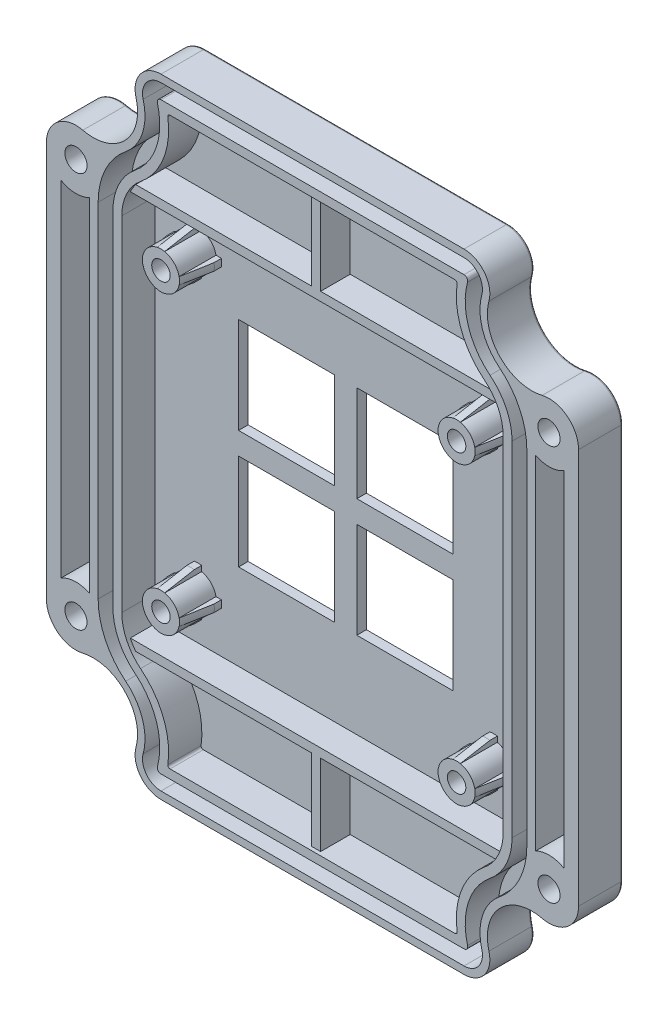
from build123d import *
from OCP.BRepFilletAPI import BRepFilletAPI_MakeChamfer

# Parameters (mm, degrees)
BOSS_EXTRUDE1_DEPTH = 6
SKETCH2_R           = 1.5
CUT_EXTRUDE1_DEPTH  = 6
SKETCH3_R           = 3
CUT_EXTRUDE2_DEPTH  = 3
FILLET1_R           = 0.3
CUT_EXTRUDE3_DEPTH  = 0.2
SKETCH5_W           = 13
SKETCH5_H           = 13
CUT_EXTRUDE4_DEPTH  = 5.8
CUT_EXTRUDE19_START = -4.5
CUT_EXTRUDE19_DEPTH = 4.5
BOSS_EXTRUDE4_DEPTH = 4.5
CUT_EXTRUDE20_DEPTH = 4.5
BOSS_EXTRUDE5_START = 4
BOSS_EXTRUDE5_DEPTH = 4
SKETCH21_R          = 2.5
BOSS_EXTRUDE6_DEPTH = 5
SKETCH22_R          = 1.25
CUT_EXTRUDE21_DEPTH = 5
BOSS_EXTRUDE9_DEPTH = 5
CHAMFER2_SIZE       = 4
CHAMFER2_SIZE2      = 0.705307923
CHAMFER3_SIZE       = 4
CHAMFER3_SIZE2      = 0.705307923
CHAMFER4_SIZE       = 4
CHAMFER4_SIZE2      = 0.705307923


with BuildPart() as part:
    # Sketch1 → Boss-Extrude1 (new body)
    with BuildSketch(Plane.XY):
        with BuildLine():
            Line((0, 69.25), (0, 15.75))
            ThreePointArc((0, 15.75), (1.521768749, 12.610195887), (4.929184933, 11.859419663))
            ThreePointArc((4.929184933, 11.859419663), (10.645991493, 10.192701489), (12.124249822, 4.424289312))
            ThreePointArc((12.124249822, 4.424289312), (12.717464053, 1.376914108), (15.5, 0))
            Line((15.5, 0), (56.5, 0))
            ThreePointArc((56.5, 0), (59.282535947, 1.376914108), (59.875750178, 4.424289312))
            ThreePointArc((59.875750178, 4.424289312), (61.354008507, 10.192701489), (67.070815067, 11.859419663))
            ThreePointArc((67.070815067, 11.859419663), (70.478231251, 12.610195887), (72, 15.75))
            Line((72, 15.75), (72, 69.25))
            ThreePointArc((72, 69.25), (70.478231251, 72.389804113), (67.070815067, 73.140580337))
            ThreePointArc((67.070815067, 73.140580337), (61.354008507, 74.807298511), (59.875750178, 80.575710688))
            ThreePointArc((59.875750178, 80.575710688), (59.282535947, 83.623085892), (56.5, 85))
            Line((56.5, 85), (15.5, 85))
            ThreePointArc((15.5, 85), (12.717464053, 83.623085892), (12.124249822, 80.575710688))
            ThreePointArc((12.124249822, 80.575710688), (10.645991493, 74.807298511), (4.929184933, 73.140580337))
            ThreePointArc((4.929184933, 73.140580337), (1.521768749, 72.389804113), (0, 69.25))
        make_face()
    extrude(amount=BOSS_EXTRUDE1_DEPTH)

    # Sketch2 → Cut-Extrude1 (cut)
    with BuildSketch(Plane.XY.offset(6)):
        with Locations((4, 69.25)):
            Circle(SKETCH2_R)
        with Locations(Location((68, 69.25, 0), (0, 0, 180))):
            Circle(SKETCH2_R)
        with Locations(Location((4, 15.75, 0), (0, 0, 180))):
            Circle(SKETCH2_R)
        with Locations((68, 15.75)):
            Circle(SKETCH2_R)
    extrude(amount=-CUT_EXTRUDE1_DEPTH, mode=Mode.SUBTRACT)

    # Sketch3 → Cut-Extrude2 (cut)
    with BuildSketch(Plane(origin=(0, 0, 0), x_dir=(-1, 0, 0), z_dir=(0, 0, -1))):
        with Locations((-68, 69.25)):
            Circle(SKETCH3_R)
        with Locations((-4, 69.25)):
            Circle(SKETCH3_R)
        with Locations((-68, 15.75)):
            Circle(SKETCH3_R)
        with Locations((-4, 15.75)):
            Circle(SKETCH3_R)
    extrude(amount=-CUT_EXTRUDE2_DEPTH, mode=Mode.SUBTRACT)

    # Fillet1
    fillet1_edges = [part.edges().sort_by_distance(p)[0] for p in [
        (10.645991493, 74.807298511, 0),
        (12.717464053, 83.623085892, 0),
        (36, 85, 0),
        (59.282535947, 83.623085892, 0),
        (61.354008507, 74.807298511, 0),
        (70.478231251, 72.389804113, 0),
        (72, 42.5, 0),
        (70.478231251, 12.610195887, 0),
        (61.354008507, 10.192701489, 0),
        (59.282535947, 1.376914108, 0),
        (36, 0, 0),
        (12.717464053, 1.376914108, 0),
        (10.645991493, 10.192701489, 0),
        (1.521768749, 12.610195887, 0),
        (0, 42.5, 0),
        (1.521768749, 72.389804113, 0),
        (7, 69.25, 0),
        (71, 15.75, 0),
        (7, 15.75, 0),
        (71, 69.25, 0),
    ]]
    fillet(fillet1_edges, radius=FILLET1_R)

    # Sketch4 → Cut-Extrude3 (cut)
    with BuildSketch(Plane(origin=(0, 0, 0), x_dir=(-1, 0, 0), z_dir=(0, 0, -1))):
        with BuildLine():
            Line((-58, 66.5), (-14, 66.5))
            ThreePointArc((-14, 66.5), (-12.585786438, 65.914213562), (-12, 64.5))
            Line((-12, 64.5), (-12, 20.5))
            ThreePointArc((-12, 20.5), (-12.585786438, 19.085786438), (-14, 18.5))
            Line((-14, 18.5), (-58, 18.5))
            ThreePointArc((-58, 18.5), (-59.414213562, 19.085786438), (-60, 20.5))
            Line((-60, 20.5), (-60, 64.5))
            ThreePointArc((-60, 64.5), (-59.414213562, 65.914213562), (-58, 66.5))
        make_face()
    extrude(amount=-CUT_EXTRUDE3_DEPTH, mode=Mode.SUBTRACT)

    # Sketch5 → Cut-Extrude4 (cut)
    with BuildSketch(Plane(origin=(0, 0, 0.2), x_dir=(-1, 0, 0), z_dir=(0, 0, -1))):
        with Locations((-28, 50.5)):
            Rectangle(SKETCH5_W, SKETCH5_H)
        with Locations((-44, 50.5)):
            Rectangle(SKETCH5_W, SKETCH5_H)
        with Locations((-44, 34.5)):
            Rectangle(SKETCH5_W, SKETCH5_H)
        with Locations((-28, 34.5)):
            Rectangle(SKETCH5_W, SKETCH5_H)
    extrude(amount=-CUT_EXTRUDE4_DEPTH, mode=Mode.SUBTRACT)

    # Sketch6 → Cut-Extrude19 (cut)
    with BuildSketch(Plane.XY.offset(6).offset(CUT_EXTRUDE19_START)):
        with BuildLine():
            Line((2, 65.785898385), (2, 19.214101615))
            ThreePointArc((2, 19.214101615), (3.886348424, 19.748385089), (5.8, 19.32211422))
            Line((5.8, 19.32211422), (5.8, 65.67788578))
            ThreePointArc((5.8, 65.67788578), (3.886348424, 65.251614911), (2, 65.785898385))
        make_face()
        with BuildLine():
            Line((66.2, 65.67788578), (66.2, 19.32211422))
            ThreePointArc((66.2, 19.32211422), (68.113651576, 19.748385089), (70, 19.214101615))
            Line((70, 19.214101615), (70, 65.785898385))
            ThreePointArc((70, 65.785898385), (68.113651576, 65.251614911), (66.2, 65.67788578))
        make_face()
        with BuildLine():
            Line((7, 19.25829985), (7, 65.74170015))
            ThreePointArc((7, 65.74170015), (7.97930907, 70.057616639), (10.725427028, 73.528209895))
            ThreePointArc((10.725427028, 73.528209895), (12.997790191, 76.831454139), (13.088749873, 80.839793348))
            ThreePointArc((13.088749873, 80.839793348), (13.512474324, 83.016489923), (15.5, 84))
            Line((15.5, 84), (56.5, 84))
            ThreePointArc((56.5, 84), (58.487525676, 83.016489923), (58.911250127, 80.839793348))
            ThreePointArc((58.911250127, 80.839793348), (59.002209809, 76.831454139), (61.274572972, 73.528209895))
            ThreePointArc((61.274572972, 73.528209895), (64.02069093, 70.057616639), (65, 65.74170015))
            Line((65, 65.74170015), (65, 19.25829985))
            ThreePointArc((65, 19.25829985), (64.02069093, 14.942383361), (61.274572972, 11.471790105))
            ThreePointArc((61.274572972, 11.471790105), (59.002209809, 8.168545861), (58.911250127, 4.160206652))
            ThreePointArc((58.911250127, 4.160206652), (58.487525676, 1.983510077), (56.5, 1))
            Line((56.5, 1), (15.5, 1))
            ThreePointArc((15.5, 1), (13.512474324, 1.983510077), (13.088749873, 4.160206652))
            ThreePointArc((13.088749873, 4.160206652), (12.997790191, 8.168545861), (10.725427028, 11.471790105))
            ThreePointArc((10.725427028, 11.471790105), (7.97930907, 14.942383361), (7, 19.25829985))
        make_face()
    extrude(amount=CUT_EXTRUDE19_DEPTH, mode=Mode.SUBTRACT)

    # Sketch13 → Boss-Extrude4 (add)
    with BuildSketch(Plane.XY.offset(1.5)):
        with BuildLine():
            Line((15.5, 82), (56.5, 82))
            ThreePointArc((56.5, 82), (56.897505135, 81.803297985), (56.982250025, 81.36795867))
            ThreePointArc((56.982250025, 81.36795867), (57.099153942, 76.216329463), (60.019658378, 71.970907946))
            ThreePointArc((60.019658378, 71.970907946), (62.216552744, 69.194433341), (63, 65.74170015))
            Line((63, 65.74170015), (63, 19.25829985))
            ThreePointArc((63, 19.25829985), (62.216552744, 15.805566659), (60.019658378, 13.029092054))
            ThreePointArc((60.019658378, 13.029092054), (57.099153942, 8.783670537), (56.982250025, 3.63204133))
            ThreePointArc((56.982250025, 3.63204133), (56.897505135, 3.196702015), (56.5, 3))
            Line((56.5, 3), (15.5, 3))
            ThreePointArc((15.5, 3), (15.102494865, 3.196702015), (15.017749975, 3.63204133))
            ThreePointArc((15.017749975, 3.63204133), (14.900846058, 8.783670537), (11.980341622, 13.029092054))
            ThreePointArc((11.980341622, 13.029092054), (9.783447256, 15.805566659), (9, 19.25829985))
            Line((9, 19.25829985), (9, 65.74170015))
            ThreePointArc((9, 65.74170015), (9.783447256, 69.194433341), (11.980341622, 71.970907946))
            ThreePointArc((11.980341622, 71.970907946), (14.900846058, 76.216329463), (15.017749975, 81.36795867))
            ThreePointArc((15.017749975, 81.36795867), (15.102494865, 81.803297985), (15.5, 82))
        make_face()
    extrude(amount=BOSS_EXTRUDE4_DEPTH)

    # Sketch14 → Cut-Extrude20 (cut)
    with BuildSketch(Plane.XY.offset(6)):
        with BuildLine():
            Line((55.271626352, 80.8), (16.728373648, 80.8))
            ThreePointArc((16.728373648, 80.8), (16.501498406, 80.696284551), (16.431492949, 80.456850833))
            ThreePointArc((16.431492949, 80.456850833), (15.831417865, 75.256349845), (12.733290379, 71.036526777))
            ThreePointArc((12.733290379, 71.036526777), (10.865930167, 68.676523362), (10.2, 65.74170015))
            Line((10.2, 65.74170015), (10.2, 19.25829985))
            ThreePointArc((10.2, 19.25829985), (10.865930167, 16.323476638), (12.733290379, 13.963473223))
            ThreePointArc((12.733290379, 13.963473223), (15.831417865, 9.743650155), (16.431492949, 4.543149167))
            ThreePointArc((16.431492949, 4.543149167), (16.501498406, 4.303715449), (16.728373648, 4.2))
            Line((16.728373648, 4.2), (55.271626352, 4.2))
            ThreePointArc((55.271626352, 4.2), (55.498501594, 4.303715449), (55.568507051, 4.543149167))
            ThreePointArc((55.568507051, 4.543149167), (56.168582135, 9.743650155), (59.266709621, 13.963473223))
            ThreePointArc((59.266709621, 13.963473223), (61.134069833, 16.323476638), (61.8, 19.25829985))
            Line((61.8, 19.25829985), (61.8, 65.74170015))
            ThreePointArc((61.8, 65.74170015), (61.134069833, 68.676523362), (59.266709621, 71.036526777))
            ThreePointArc((59.266709621, 71.036526777), (56.168582135, 75.256349845), (55.568507051, 80.456850833))
            ThreePointArc((55.568507051, 80.456850833), (55.498501594, 80.696284551), (55.271626352, 80.8))
        make_face()
    extrude(amount=-CUT_EXTRUDE20_DEPTH, mode=Mode.SUBTRACT)

    # Sketch17 → Boss-Extrude5 (add)
    with BuildSketch(Plane.XY.offset(1.5).offset(BOSS_EXTRUDE5_START)):
        with BuildLine():
            Line((10.853310486, 68.65), (61.146689514, 68.65))
            ThreePointArc((61.146689514, 68.65), (60.813718714, 69.268834215), (60.418659644, 69.85))
            Line((60.418659644, 69.85), (36.6, 69.85))
            Line((36.6, 69.85), (36.6, 80.8))
            Line((36.6, 80.8), (35.4, 80.8))
            Line((35.4, 80.8), (35.4, 69.85))
            Line((35.4, 69.85), (11.581340356, 69.85))
            ThreePointArc((11.581340356, 69.85), (11.186281286, 69.268834215), (10.853310486, 68.65))
        make_face()
        with BuildLine():
            Line((60.418659644, 15.15), (36.6, 15.15))
            Line((36.6, 15.15), (36.6, 4.2))
            Line((36.6, 4.2), (35.4, 4.2))
            Line((35.4, 4.2), (35.4, 15.15))
            Line((35.4, 15.15), (11.581340356, 15.15))
            ThreePointArc((11.581340356, 15.15), (11.186281286, 15.731165785), (10.853310486, 16.35))
            Line((10.853310486, 16.35), (61.146689514, 16.35))
            ThreePointArc((61.146689514, 16.35), (60.813718714, 15.731165785), (60.418659644, 15.15))
        make_face()
    extrude(amount=-BOSS_EXTRUDE5_DEPTH)

    # Sketch21 → Boss-Extrude6 (add)
    with BuildSketch(Plane.XY.offset(1.5)):
        with Locations((16, 62.5)):
            Circle(SKETCH21_R)
        with Locations(Location((56, 62.5, 0), (0, 0, 180))):
            Circle(SKETCH21_R)
        with Locations((56, 22.5)):
            Circle(SKETCH21_R)
        with Locations(Location((16, 22.5, 0), (0, 0, 180))):
            Circle(SKETCH21_R)
    extrude(amount=BOSS_EXTRUDE6_DEPTH)

    # Sketch22 → Cut-Extrude21 (cut)
    with BuildSketch(Plane.XY.offset(6.5)):
        with Locations((16, 62.5)):
            Circle(SKETCH22_R)
        with Locations(Location((56, 62.5, 0), (0, 0, 180))):
            Circle(SKETCH22_R)
        with Locations((56, 22.5)):
            Circle(SKETCH22_R)
        with Locations(Location((16, 22.5, 0), (0, 0, 180))):
            Circle(SKETCH22_R)
    extrude(amount=-CUT_EXTRUDE21_DEPTH, mode=Mode.SUBTRACT)

    # Sketch23 → Boss-Extrude9 (add)
    with BuildSketch(Plane.XY.offset(1.5)):
        with BuildLine():
            Line((18.449489743, 63), (19.180167892, 63))
            ThreePointArc((19.180167892, 63), (19.219234043, 62.5), (19.180167892, 62))
            Line((19.180167892, 62), (18.449489743, 62))
            ThreePointArc((18.449489743, 62), (18.5, 62.5), (18.449489743, 63))
        make_face()
        with BuildLine():
            Line((53.550510257, 63), (52.819832108, 63))
            ThreePointArc((52.819832108, 63), (52.780765957, 62.5), (52.819832108, 62))
            Line((52.819832108, 62), (53.550510257, 62))
            ThreePointArc((53.550510257, 62), (53.5, 62.5), (53.550510257, 63))
        make_face()
        with BuildLine():
            Line((53.550510257, 22), (52.819832108, 22))
            ThreePointArc((52.819832108, 22), (52.780765957, 22.5), (52.819832108, 23))
            Line((52.819832108, 23), (53.550510257, 23))
            ThreePointArc((53.550510257, 23), (53.5, 22.5), (53.550510257, 22))
        make_face()
        with BuildLine():
            Line((18.449489743, 22), (19.180167892, 22))
            ThreePointArc((19.180167892, 22), (19.219234043, 22.5), (19.180167892, 23))
            Line((19.180167892, 23), (18.449489743, 23))
            ThreePointArc((18.449489743, 23), (18.5, 22.5), (18.449489743, 22))
        make_face()
        with BuildLine():
            Line((15.5, 60.050510257), (15.5, 59.319832108))
            ThreePointArc((15.5, 59.319832108), (16, 59.280765957), (16.5, 59.319832108))
            Line((16.5, 59.319832108), (16.5, 60.050510257))
            ThreePointArc((16.5, 60.050510257), (16, 60), (15.5, 60.050510257))
        make_face()
        with BuildLine():
            Line((15.5, 24.949489743), (15.5, 25.680167892))
            ThreePointArc((15.5, 25.680167892), (16, 25.719234043), (16.5, 25.680167892))
            Line((16.5, 25.680167892), (16.5, 24.949489743))
            ThreePointArc((16.5, 24.949489743), (16, 25), (15.5, 24.949489743))
        make_face()
        with BuildLine():
            Line((56.5, 60.050510257), (56.5, 59.319832108))
            ThreePointArc((56.5, 59.319832108), (56, 59.280765957), (55.5, 59.319832108))
            Line((55.5, 59.319832108), (55.5, 60.050510257))
            ThreePointArc((55.5, 60.050510257), (56, 60), (56.5, 60.050510257))
        make_face()
        with BuildLine():
            Line((55.5, 24.949489743), (55.5, 25.680167892))
            ThreePointArc((55.5, 25.680167892), (56, 25.719234043), (56.5, 25.680167892))
            Line((56.5, 25.680167892), (56.5, 24.949489743))
            ThreePointArc((56.5, 24.949489743), (56, 25), (55.5, 24.949489743))
        make_face()
        with BuildLine():
            Line((58.449489743, 63), (59.180167892, 63))
            ThreePointArc((59.180167892, 63), (59.219234043, 62.5), (59.180167892, 62))
            Line((59.180167892, 62), (58.449489743, 62))
            ThreePointArc((58.449489743, 62), (58.5, 62.5), (58.449489743, 63))
        make_face()
        with BuildLine():
            Line((55.5, 64.949489743), (55.5, 65.680167892))
            ThreePointArc((55.5, 65.680167892), (56, 65.719234043), (56.5, 65.680167892))
            Line((56.5, 65.680167892), (56.5, 64.949489743))
            ThreePointArc((56.5, 64.949489743), (56, 65), (55.5, 64.949489743))
        make_face()
        with BuildLine():
            Line((15.5, 64.949489743), (15.5, 65.680167892))
            ThreePointArc((15.5, 65.680167892), (16, 65.719234043), (16.5, 65.680167892))
            Line((16.5, 65.680167892), (16.5, 64.949489743))
            ThreePointArc((16.5, 64.949489743), (16, 65), (15.5, 64.949489743))
        make_face()
        with BuildLine():
            Line((13.550510257, 62), (12.819832108, 62))
            ThreePointArc((12.819832108, 62), (12.780765957, 62.5), (12.819832108, 63))
            Line((12.819832108, 63), (13.550510257, 63))
            ThreePointArc((13.550510257, 63), (13.5, 62.5), (13.550510257, 62))
        make_face()
        with BuildLine():
            Line((13.550510257, 22), (12.819832108, 22))
            ThreePointArc((12.819832108, 22), (12.780765957, 22.5), (12.819832108, 23))
            Line((12.819832108, 23), (13.550510257, 23))
            ThreePointArc((13.550510257, 23), (13.5, 22.5), (13.550510257, 22))
        make_face()
        with BuildLine():
            Line((16.5, 20.050510257), (16.5, 19.319832108))
            ThreePointArc((16.5, 19.319832108), (16, 19.280765957), (15.5, 19.319832108))
            Line((15.5, 19.319832108), (15.5, 20.050510257))
            ThreePointArc((15.5, 20.050510257), (16, 20), (16.5, 20.050510257))
        make_face()
        with BuildLine():
            Line((56.5, 20.050510257), (56.5, 19.319832108))
            ThreePointArc((56.5, 19.319832108), (56, 19.280765957), (55.5, 19.319832108))
            Line((55.5, 19.319832108), (55.5, 20.050510257))
            ThreePointArc((55.5, 20.050510257), (56, 20), (56.5, 20.050510257))
        make_face()
        with BuildLine():
            Line((58.449489743, 23), (59.180167892, 23))
            ThreePointArc((59.180167892, 23), (59.219234043, 22.5), (59.180167892, 22))
            Line((59.180167892, 22), (58.449489743, 22))
            ThreePointArc((58.449489743, 22), (58.5, 22.5), (58.449489743, 23))
        make_face()
    extrude(amount=BOSS_EXTRUDE9_DEPTH)

    # Chamfer2
    chamfer2_edges = [part.edges().sort_by_distance(p)[0] for p in [
        (16, 59.280765957, 6.5),
    ]]
    chamfer2_side = [part.faces().sort_by_distance(p)[0] for p in [
        (16, 59.280765957, 4),
    ]]
    chamfer(chamfer2_edges, length=CHAMFER2_SIZE, length2=CHAMFER2_SIZE2, reference=chamfer2_side[0])

    # Chamfer3: one chamfer whose edges measure the first distance from different faces: ONE call of the kernel's chamfer builder (chamfer() names one face for all edges)
    chamfer3_edges_1 = [part.edges().sort_by_distance(p)[0] for p in [
        (19.219234043, 62.5, 6.5),
    ]]
    chamfer3_side_1 = [part.faces().sort_by_distance(p)[0] for p in [
        (19.219234043, 62.5, 4),
    ]]
    chamfer3_edges_2 = [part.edges().sort_by_distance(p)[0] for p in [
        (16, 65.719234043, 6.5),
    ]]
    chamfer3_side_2 = [part.faces().sort_by_distance(p)[0] for p in [
        (16, 65.719234043, 4),
    ]]
    chamfer3_edges_3 = [part.edges().sort_by_distance(p)[0] for p in [
        (12.780765957, 62.5, 6.5),
    ]]
    chamfer3_side_3 = [part.faces().sort_by_distance(p)[0] for p in [
        (12.780765957, 62.5, 4),
    ]]
    chamfer3 = BRepFilletAPI_MakeChamfer(part.part.solid().wrapped)
    for e in chamfer3_edges_1:
        chamfer3.Add(CHAMFER3_SIZE, CHAMFER3_SIZE2, e.wrapped, chamfer3_side_1[0].wrapped)  # the first distance lies on this face
    for e in chamfer3_edges_2:
        chamfer3.Add(CHAMFER3_SIZE, CHAMFER3_SIZE2, e.wrapped, chamfer3_side_2[0].wrapped)  # the first distance lies on this face
    for e in chamfer3_edges_3:
        chamfer3.Add(CHAMFER3_SIZE, CHAMFER3_SIZE2, e.wrapped, chamfer3_side_3[0].wrapped)  # the first distance lies on this face
    add(Compound.cast(chamfer3.Shape()), mode=Mode.REPLACE)

    # Chamfer4: one chamfer whose edges measure the first distance from different faces: ONE call of the kernel's chamfer builder (chamfer() names one face for all edges)
    chamfer4_edges_1 = [part.edges().sort_by_distance(p)[0] for p in [
        (52.780765957, 62.5, 6.5),
    ]]
    chamfer4_side_1 = [part.faces().sort_by_distance(p)[0] for p in [
        (52.780765957, 62.5, 4),
    ]]
    chamfer4_edges_2 = [part.edges().sort_by_distance(p)[0] for p in [
        (52.780765957, 22.5, 6.5),
    ]]
    chamfer4_side_2 = [part.faces().sort_by_distance(p)[0] for p in [
        (52.780765957, 22.5, 4),
    ]]
    chamfer4_edges_3 = [part.edges().sort_by_distance(p)[0] for p in [
        (19.219234043, 22.5, 6.5),
    ]]
    chamfer4_side_3 = [part.faces().sort_by_distance(p)[0] for p in [
        (19.219234043, 22.5, 4),
    ]]
    chamfer4_edges_4 = [part.edges().sort_by_distance(p)[0] for p in [
        (16, 25.719234043, 6.5),
    ]]
    chamfer4_side_4 = [part.faces().sort_by_distance(p)[0] for p in [
        (16, 25.719234043, 4),
    ]]
    chamfer4_edges_5 = [part.edges().sort_by_distance(p)[0] for p in [
        (56, 59.280765957, 6.5),
    ]]
    chamfer4_side_5 = [part.faces().sort_by_distance(p)[0] for p in [
        (56, 59.280765957, 4),
    ]]
    chamfer4_edges_6 = [part.edges().sort_by_distance(p)[0] for p in [
        (56, 25.719234043, 6.5),
    ]]
    chamfer4_side_6 = [part.faces().sort_by_distance(p)[0] for p in [
        (56, 25.719234043, 4),
    ]]
    chamfer4_edges_7 = [part.edges().sort_by_distance(p)[0] for p in [
        (59.219234043, 62.5, 6.5),
    ]]
    chamfer4_side_7 = [part.faces().sort_by_distance(p)[0] for p in [
        (59.219234043, 62.5, 4),
    ]]
    chamfer4_edges_8 = [part.edges().sort_by_distance(p)[0] for p in [
        (56, 65.719234043, 6.5),
    ]]
    chamfer4_side_8 = [part.faces().sort_by_distance(p)[0] for p in [
        (56, 65.719234043, 4),
    ]]
    chamfer4_edges_9 = [part.edges().sort_by_distance(p)[0] for p in [
        (12.780765957, 22.5, 6.5),
    ]]
    chamfer4_side_9 = [part.faces().sort_by_distance(p)[0] for p in [
        (12.780765957, 22.5, 4),
    ]]
    chamfer4_edges_10 = [part.edges().sort_by_distance(p)[0] for p in [
        (16, 19.280765957, 6.5),
    ]]
    chamfer4_side_10 = [part.faces().sort_by_distance(p)[0] for p in [
        (16, 19.280765957, 4),
    ]]
    chamfer4_edges_11 = [part.edges().sort_by_distance(p)[0] for p in [
        (56, 19.280765957, 6.5),
    ]]
    chamfer4_side_11 = [part.faces().sort_by_distance(p)[0] for p in [
        (56, 19.280765957, 4),
    ]]
    chamfer4_edges_12 = [part.edges().sort_by_distance(p)[0] for p in [
        (59.219234043, 22.5, 6.5),
    ]]
    chamfer4_side_12 = [part.faces().sort_by_distance(p)[0] for p in [
        (59.219234043, 22.5, 4),
    ]]
    chamfer4 = BRepFilletAPI_MakeChamfer(part.part.solid().wrapped)
    for e in chamfer4_edges_1:
        chamfer4.Add(CHAMFER4_SIZE, CHAMFER4_SIZE2, e.wrapped, chamfer4_side_1[0].wrapped)  # the first distance lies on this face
    for e in chamfer4_edges_2:
        chamfer4.Add(CHAMFER4_SIZE, CHAMFER4_SIZE2, e.wrapped, chamfer4_side_2[0].wrapped)  # the first distance lies on this face
    for e in chamfer4_edges_3:
        chamfer4.Add(CHAMFER4_SIZE, CHAMFER4_SIZE2, e.wrapped, chamfer4_side_3[0].wrapped)  # the first distance lies on this face
    for e in chamfer4_edges_4:
        chamfer4.Add(CHAMFER4_SIZE, CHAMFER4_SIZE2, e.wrapped, chamfer4_side_4[0].wrapped)  # the first distance lies on this face
    for e in chamfer4_edges_5:
        chamfer4.Add(CHAMFER4_SIZE, CHAMFER4_SIZE2, e.wrapped, chamfer4_side_5[0].wrapped)  # the first distance lies on this face
    for e in chamfer4_edges_6:
        chamfer4.Add(CHAMFER4_SIZE, CHAMFER4_SIZE2, e.wrapped, chamfer4_side_6[0].wrapped)  # the first distance lies on this face
    for e in chamfer4_edges_7:
        chamfer4.Add(CHAMFER4_SIZE, CHAMFER4_SIZE2, e.wrapped, chamfer4_side_7[0].wrapped)  # the first distance lies on this face
    for e in chamfer4_edges_8:
        chamfer4.Add(CHAMFER4_SIZE, CHAMFER4_SIZE2, e.wrapped, chamfer4_side_8[0].wrapped)  # the first distance lies on this face
    for e in chamfer4_edges_9:
        chamfer4.Add(CHAMFER4_SIZE, CHAMFER4_SIZE2, e.wrapped, chamfer4_side_9[0].wrapped)  # the first distance lies on this face
    for e in chamfer4_edges_10:
        chamfer4.Add(CHAMFER4_SIZE, CHAMFER4_SIZE2, e.wrapped, chamfer4_side_10[0].wrapped)  # the first distance lies on this face
    for e in chamfer4_edges_11:
        chamfer4.Add(CHAMFER4_SIZE, CHAMFER4_SIZE2, e.wrapped, chamfer4_side_11[0].wrapped)  # the first distance lies on this face
    for e in chamfer4_edges_12:
        chamfer4.Add(CHAMFER4_SIZE, CHAMFER4_SIZE2, e.wrapped, chamfer4_side_12[0].wrapped)  # the first distance lies on this face
    add(Compound.cast(chamfer4.Shape()), mode=Mode.REPLACE)


solid = part.part
